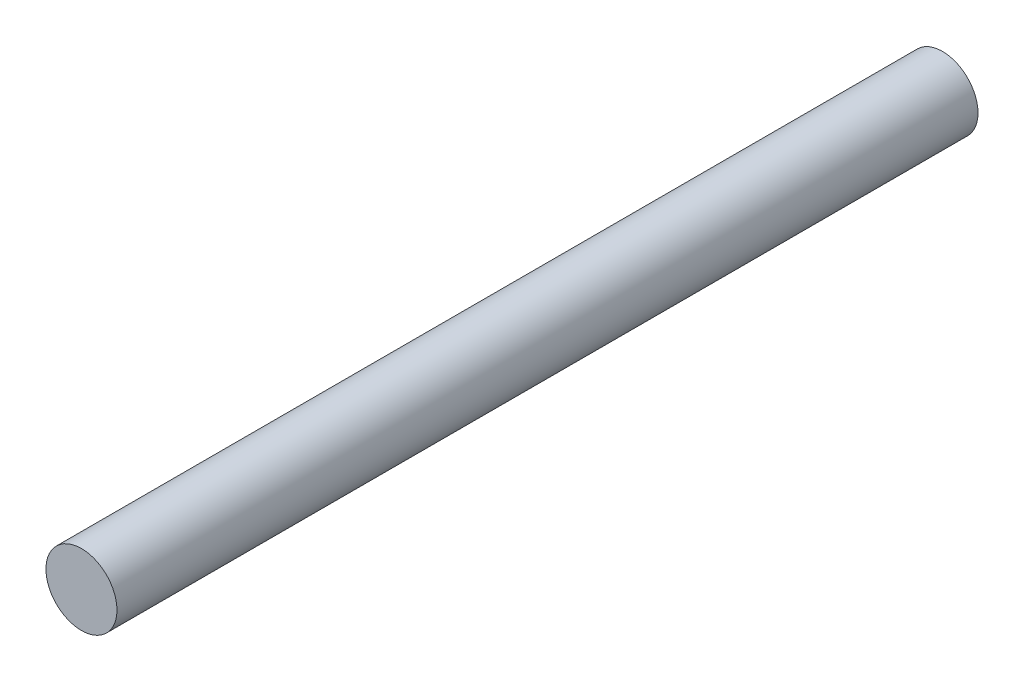
from build123d import *

# Parameters (mm, degrees)
SKETCH1_R      = 4.191
EXTRUDE1_DEPTH = 101.6


with BuildPart() as part:
    # Sketch1 → Extrude1 (new body)
    with BuildSketch(Plane.XY):
        Circle(SKETCH1_R)
    extrude(amount=EXTRUDE1_DEPTH)


solid = part.part
